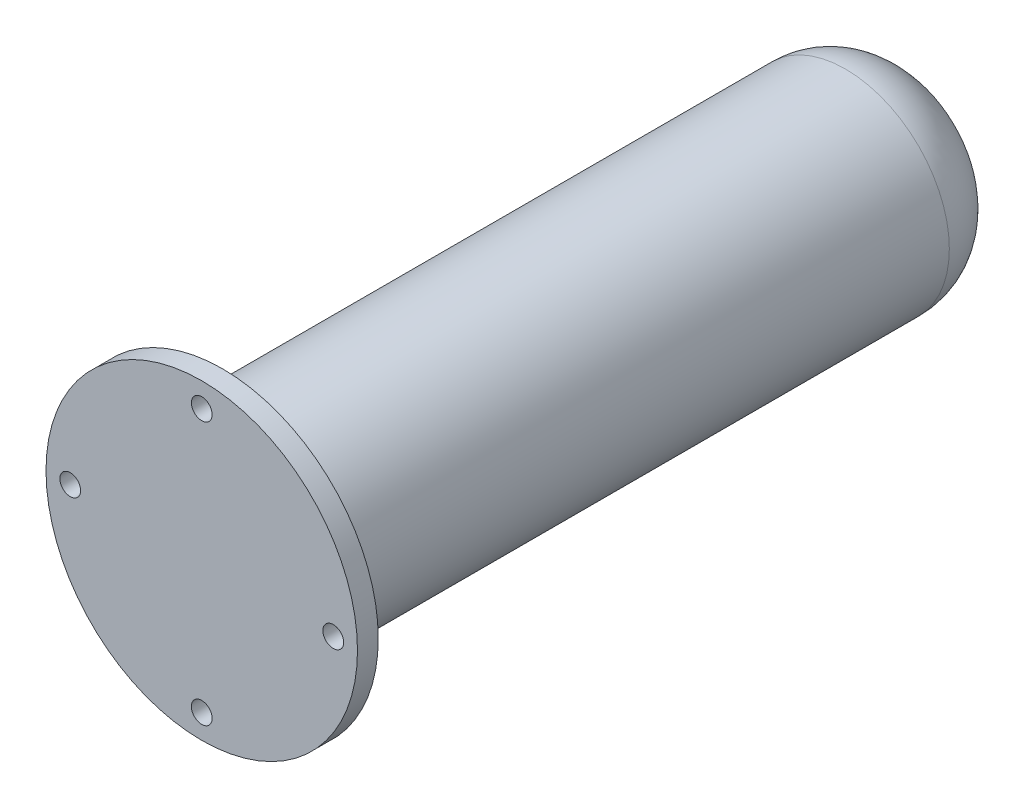
from build123d import *

# Parameters (mm, degrees)
ESQUISSE1_R        = 22.5
ESQUISSE1_R_2      = 1.5
BOSS_EXTRU_1_DEPTH = 3
ESQUISSE2_R        = 15
BOSS_EXTRU_2_DEPTH = 100
CONG_1_R           = 10


with BuildPart() as part:
    # Esquisse1 → Boss.-Extru.1 (new body)
    with BuildSketch(Plane.XY):
        Circle(ESQUISSE1_R)
        with Locations((0, 19)):
            Circle(ESQUISSE1_R_2, mode=Mode.SUBTRACT)
        with Locations((19, 0)):
            Circle(ESQUISSE1_R_2, mode=Mode.SUBTRACT)
        with Locations((0, -19)):
            Circle(ESQUISSE1_R_2, mode=Mode.SUBTRACT)
        with Locations((-19, 0)):
            Circle(ESQUISSE1_R_2, mode=Mode.SUBTRACT)
    extrude(amount=BOSS_EXTRU_1_DEPTH)

    # Esquisse2 → Boss.-Extru.2 (add)
    with BuildSketch(Plane(origin=(0, 0, 0), x_dir=(-1, 0, 0), z_dir=(0, 0, -1))):
        Circle(ESQUISSE2_R)
    extrude(amount=BOSS_EXTRU_2_DEPTH)

    # Congé1
    cong_1_edges = [part.edges().sort_by_distance(p)[0] for p in [
        (15, 0, -100),
    ]]
    fillet(cong_1_edges, radius=CONG_1_R)


solid = part.part
